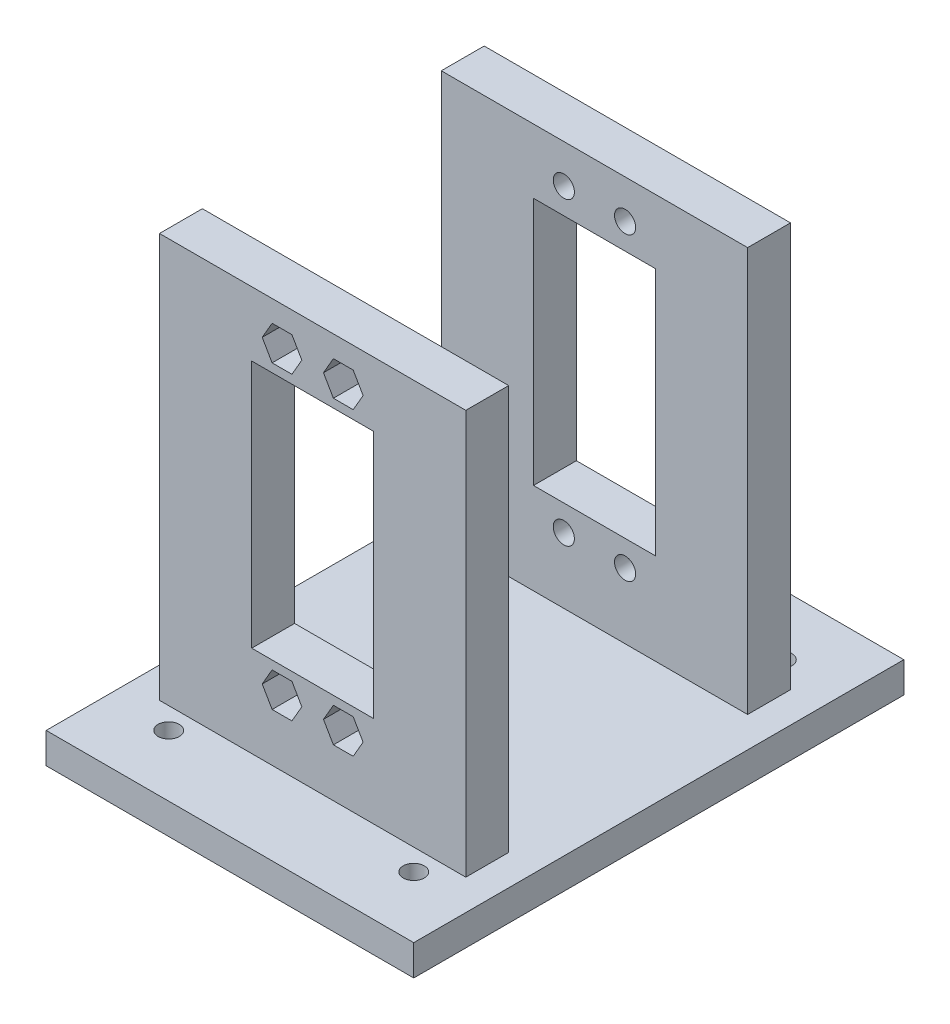
from build123d import *

# Parameters (mm, degrees)
SKETCH1_W           = 60
SKETCH1_H           = 80
BOSS_EXTRUDE1_DEPTH = 2.5
SKETCH2_R           = 1.725
CUT_EXTRUDE1_DEPTH  = 51.249378106
SKETCH3_W           = 50
SKETCH3_H           = 66
BOSS_EXTRUDE2_DEPTH = 7
SKETCH4_W           = 19.9
SKETCH4_H           = 40.6
CUT_EXTRUDE2_DEPTH  = 101.072473738
SKETCH5_R           = 1.725
CUT_EXTRUDE3_DEPTH  = 101.072473738
CUT_EXTRUDE4_DEPTH  = 4.2


with BuildPart() as part:
    # Sketch1 → Boss-Extrude1 (new, symmetric)
    with BuildSketch(Plane(origin=(0, 0, 0), x_dir=(1, 0, 0), z_dir=(0, 1, 0))):
        Rectangle(SKETCH1_W, SKETCH1_H)
    extrude(amount=BOSS_EXTRUDE1_DEPTH, both=True)

    # Sketch2 → Cut-Extrude1 (cut, through all)
    with BuildSketch(Plane(origin=(0, 2.5, 0), x_dir=(1, 0, 0), z_dir=(0, 1, 0))):
        with Locations(Location((-20, 30, 0), (0, 0, 270))):
            Circle(SKETCH2_R)
        with Locations(Location((20, 30, 0), (0, 0, 270))):
            Circle(SKETCH2_R)
        with Locations(Location((20, -30, 0), (0, 0, 270))):
            Circle(SKETCH2_R)
        with Locations(Location((-20, -30, 0), (0, 0, 270))):
            Circle(SKETCH2_R)
    extrude(amount=-CUT_EXTRUDE1_DEPTH, mode=Mode.SUBTRACT)

    # Sketch3 → Boss-Extrude2 (add)
    with BuildSketch(Plane.XY.offset(19.5)):
        with Locations((0, 35.5)):
            Rectangle(SKETCH3_W, SKETCH3_H)
    boss_extrude2 = extrude(amount=BOSS_EXTRUDE2_DEPTH)

    # Mirror1: Boss-Extrude2 across plane
    add(boss_extrude2.mirror(Plane.XY))

    # Sketch4 → Cut-Extrude2 (cut, through all)
    with BuildSketch(Plane.XY.offset(26.5)):
        with Locations((0, 37.7)):
            Rectangle(SKETCH4_W, SKETCH4_H)
    extrude(amount=-CUT_EXTRUDE2_DEPTH, mode=Mode.SUBTRACT)

    # Sketch5 → Cut-Extrude3 (cut, through all)
    with BuildSketch(Plane.XY.offset(26.5)):
        with Locations((-5, 62.2)):
            Circle(SKETCH5_R)
        with Locations((5, 62.2)):
            Circle(SKETCH5_R)
        with Locations((-5, 13.2)):
            Circle(SKETCH5_R)
        with Locations((5, 13.2)):
            Circle(SKETCH5_R)
    extrude(amount=-CUT_EXTRUDE3_DEPTH, mode=Mode.SUBTRACT)

    # Sketch6 → Cut-Extrude4 (cut)
    with BuildSketch(Plane.XY.offset(26.5)):
        Polygon((-1.766838493, 62.2), (-3.383419246, 65), (-6.616580754, 65), (-8.233161507, 62.2), (-6.616580754, 59.4), (-3.383419246, 59.4), align=None)
        Polygon((1.766838493, 62.2), (3.383419246, 59.4), (6.616580754, 59.4), (8.233161507, 62.2), (6.616580754, 65), (3.383419246, 65), align=None)
        Polygon((-1.766838493, 13.2), (-3.383419246, 16), (-6.616580754, 16), (-8.233161507, 13.2), (-6.616580754, 10.4), (-3.383419246, 10.4), align=None)
        Polygon((8.233161507, 13.2), (6.616580754, 16), (3.383419246, 16), (1.766838493, 13.2), (3.383419246, 10.4), (6.616580754, 10.4), align=None)
    cut_extrude4 = extrude(amount=-CUT_EXTRUDE4_DEPTH, mode=Mode.SUBTRACT)

    # Mirror3: Cut-Extrude4 across plane
    add(cut_extrude4.mirror(Plane.XY), mode=Mode.SUBTRACT)


solid = part.part
